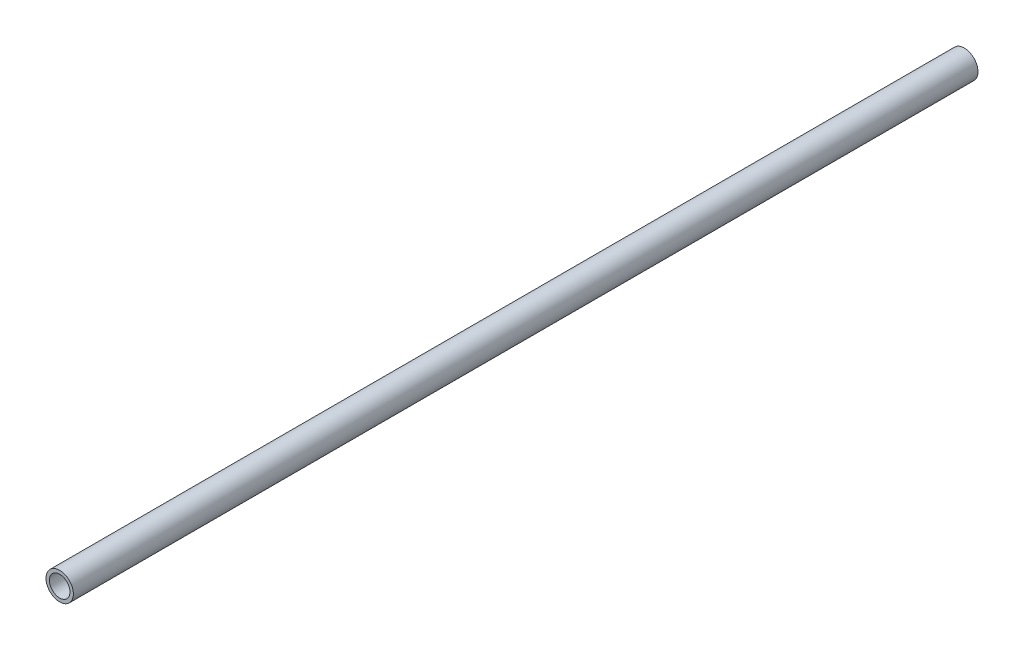
from build123d import *

# Parameters (mm, degrees)
SKETCH1_R           = 14.224
BOSS_EXTRUDE1_DEPTH = 939.8
SKETCH2_R           = 10.6934
CUT_EXTRUDE1_DEPTH  = 941.01525751


with BuildPart() as part:
    # Sketch1 → Boss-Extrude1 (new body)
    with BuildSketch(Plane.XY):
        Circle(SKETCH1_R)
    extrude(amount=BOSS_EXTRUDE1_DEPTH)

    # Sketch2 → Cut-Extrude1 (cut, through all)
    with BuildSketch(Plane.XY.offset(939.8)):
        Circle(SKETCH2_R)
    extrude(amount=-CUT_EXTRUDE1_DEPTH, mode=Mode.SUBTRACT)


solid = part.part
